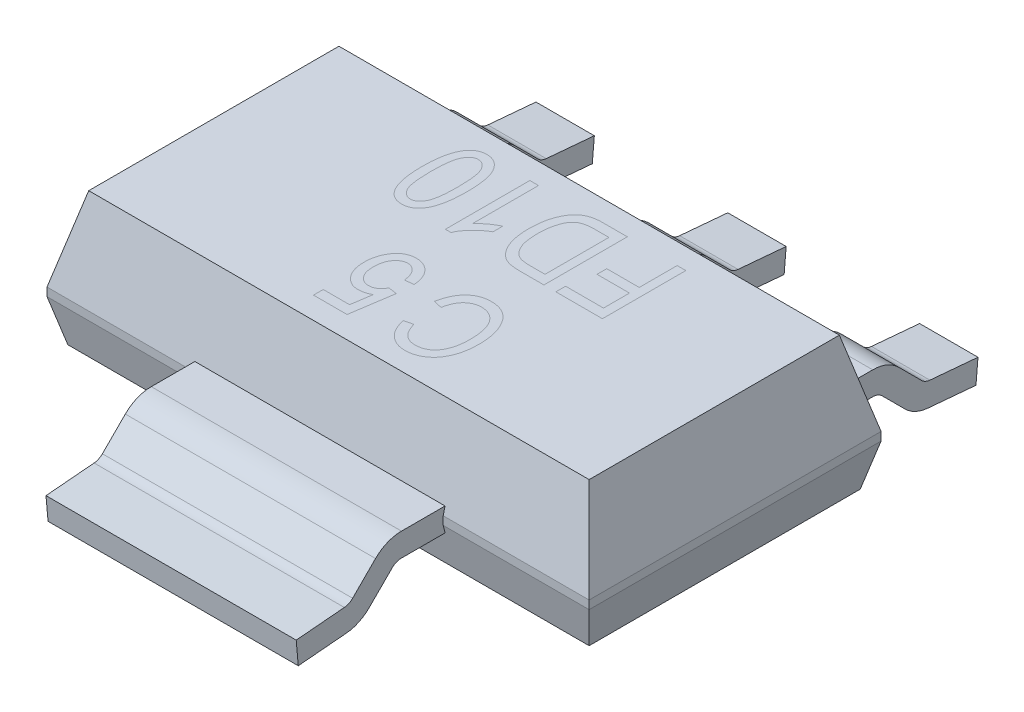
from build123d import *
from OCP.BRepFilletAPI import BRepFilletAPI_MakeChamfer

# Parameters (mm, degrees)
SKETCH1_W           = 6.5
SKETCH1_H           = 3.5
BOSS_EXTRUDE1_DEPTH = 1.6
CHAMFER1_SIZE       = 1
CHAMFER1_SIZE2      = 0.25
CHAMFER2_SIZE       = 0.125
CHAMFER2_SIZE2      = 0.5
EXTRUDE_THIN1_DEPTH = 1.5
EXTRUDE_THIN2_DEPTH = 0.35
LPATTERN1_COUNT     = 3
LPATTERN1_PITCH     = 2.3


with BuildPart() as part:
    # Sketch1 → Boss-Extrude1 (new body)
    with BuildSketch(Plane(origin=(0, 0, 0), x_dir=(1, 0, 0), z_dir=(0, 1, 0))):
        Rectangle(SKETCH1_W, SKETCH1_H)
    extrude(amount=BOSS_EXTRUDE1_DEPTH)

    # Chamfer1: one chamfer whose edges measure the first distance from different faces: ONE call of the kernel's chamfer builder (chamfer() names one face for all edges)
    chamfer1_edges_1 = [part.edges().sort_by_distance(p)[0] for p in [
        (3.25, 1.6, 0),
    ]]
    chamfer1_side_1 = [part.faces().sort_by_distance(p)[0] for p in [
        (3.25, 0.8, 0),
    ]]
    chamfer1_edges_2 = [part.edges().sort_by_distance(p)[0] for p in [
        (0, 1.6, -1.75),
    ]]
    chamfer1_side_2 = [part.faces().sort_by_distance(p)[0] for p in [
        (0, 0.8, -1.75),
    ]]
    chamfer1_edges_3 = [part.edges().sort_by_distance(p)[0] for p in [
        (-3.25, 1.6, 0),
    ]]
    chamfer1_side_3 = [part.faces().sort_by_distance(p)[0] for p in [
        (-3.25, 0.8, 0),
    ]]
    chamfer1_edges_4 = [part.edges().sort_by_distance(p)[0] for p in [
        (0, 1.6, 1.75),
    ]]
    chamfer1_side_4 = [part.faces().sort_by_distance(p)[0] for p in [
        (0, 0.8, 1.75),
    ]]
    chamfer1 = BRepFilletAPI_MakeChamfer(part.part.solid().wrapped)
    for e in chamfer1_edges_1:
        chamfer1.Add(CHAMFER1_SIZE, CHAMFER1_SIZE2, e.wrapped, chamfer1_side_1[0].wrapped)  # the first distance lies on this face
    for e in chamfer1_edges_2:
        chamfer1.Add(CHAMFER1_SIZE, CHAMFER1_SIZE2, e.wrapped, chamfer1_side_2[0].wrapped)  # the first distance lies on this face
    for e in chamfer1_edges_3:
        chamfer1.Add(CHAMFER1_SIZE, CHAMFER1_SIZE2, e.wrapped, chamfer1_side_3[0].wrapped)  # the first distance lies on this face
    for e in chamfer1_edges_4:
        chamfer1.Add(CHAMFER1_SIZE, CHAMFER1_SIZE2, e.wrapped, chamfer1_side_4[0].wrapped)  # the first distance lies on this face
    add(Compound.cast(chamfer1.Shape()), mode=Mode.REPLACE)

    # Chamfer2
    chamfer2_edges = [part.edges().sort_by_distance(p)[0] for p in [
        (0, 0, -1.75),
        (3.25, 0, 0),
        (0, 0, 1.75),
        (-3.25, 0, 0),
    ]]
    chamfer2_side = [part.faces().sort_by_distance(p)[0] for p in [
        (0, 0, 0),
    ]]
    chamfer(chamfer2_edges, length=CHAMFER2_SIZE, length2=CHAMFER2_SIZE2, reference=chamfer2_side[0])

    # Sketch2 → Extrude-Thin1 (add, symmetric)
    with BuildSketch(Plane(origin=(0, 0, 0), x_dir=(0, 0, -1), z_dir=(1, 0, 0))):
        with BuildLine():
            Line((0, 0.69), (-2.25, 0.69))
            ThreePointArc((-2.25, 0.69), (-2.41838071, 0.656506994), (-2.561126984, 0.561126984))
            Line((-2.561126984, 0.561126984), (-2.836055715, 0.286198252))
            ThreePointArc((-2.836055715, 0.286198252), (-2.881573879, 0.254326091), (-2.935247882, 0.239944185))
            Line((-2.935247882, 0.239944185), (-3.512201804, 0.189467258))
            Line((-3.512201804, 0.189467258), (-3.487798196, -0.089467258))
            Line((-3.487798196, -0.089467258), (-2.910844274, -0.03899033))
            ThreePointArc((-2.910844274, -0.03899033), (-2.763240765, 0.000559911), (-2.638065817, 0.088208353))
            Line((-2.638065817, 0.088208353), (-2.363137085, 0.363137085))
            ThreePointArc((-2.363137085, 0.363137085), (-2.311229349, 0.397820725), (-2.25, 0.41))
            Line((-2.25, 0.41), (0, 0.41))
            Line((0, 0.41), (0, 0.69))
        make_face()
    extrude(amount=EXTRUDE_THIN1_DEPTH, both=True)

    # Sketch3 → Extrude-Thin2 (add, symmetric)
    with BuildSketch(Plane(origin=(2.3, 0, 0), x_dir=(0, 0, -1), z_dir=(1, 0, 0))):
        with BuildLine():
            Line((0, 0.41), (2.25, 0.41))
            ThreePointArc((2.25, 0.41), (2.311229349, 0.397820725), (2.363137085, 0.363137085))
            Line((2.363137085, 0.363137085), (2.638065817, 0.088208353))
            ThreePointArc((2.638065817, 0.088208353), (2.763240765, 0.000559911), (2.910844274, -0.03899033))
            Line((2.910844274, -0.03899033), (3.487798196, -0.089467258))
            Line((3.487798196, -0.089467258), (3.512201804, 0.189467258))
            Line((3.512201804, 0.189467258), (2.935247882, 0.239944185))
            ThreePointArc((2.935247882, 0.239944185), (2.881573879, 0.254326091), (2.836055715, 0.286198252))
            Line((2.836055715, 0.286198252), (2.561126984, 0.561126984))
            ThreePointArc((2.561126984, 0.561126984), (2.41838071, 0.656506994), (2.25, 0.69))
            Line((2.25, 0.69), (0, 0.69))
            Line((0, 0.69), (0, 0.41))
        make_face()
    extrude_thin2 = extrude(amount=EXTRUDE_THIN2_DEPTH, both=True)

    # LPattern1: Extrude-Thin2 ×3
    with Locations(*[(-i * LPATTERN1_PITCH, 0, 0) for i in range(1, LPATTERN1_COUNT)]):
        add(extrude_thin2)


solid = part.part
